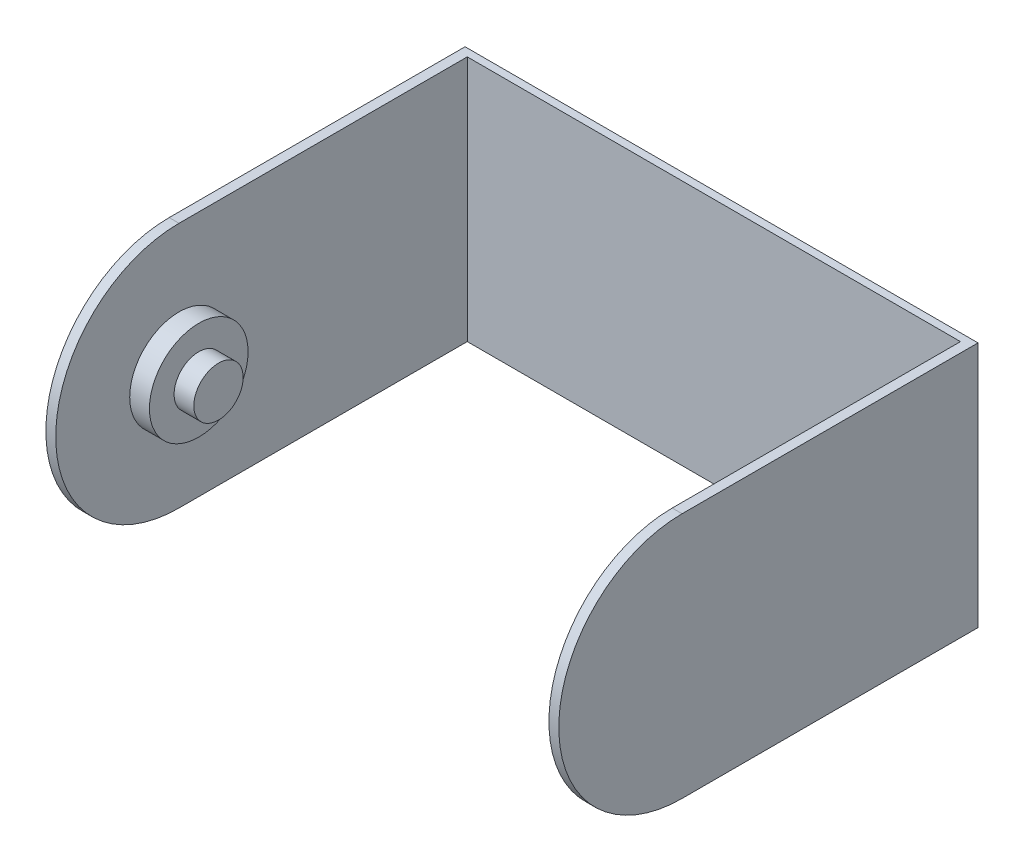
from build123d import *

# Parameters (mm, degrees)
BOSS_EXTRU_1_DEPTH = 25
BOSS_EXTRU_2_DEPTH = 1
BOSS_EXTRU_3_START = -1
BOSS_EXTRU_3_DEPTH = 1
ESQUISSE6_R        = 5
BOSS_EXTRU_4_DEPTH = 2
ESQUISSE7_R        = 2.5
BOSS_EXTRU_5_DEPTH = 2


with BuildPart() as part:
    # Esquisse1 → Boss.-Extru.1 (new body)
    with BuildSketch(Plane(origin=(0, 0, 0), x_dir=(1, 0, 0), z_dir=(0, 1, 0))):
        Polygon((-3.234042553, -21.946808511), (-2.234042553, -21.946808511), (-2.234042553, 7.275558935), (47.765957447, 7.275558935), (47.765957447, -21.946808511), (48.765957447, -21.946808511), (48.765957447, 8.053191489), (-3.234042553, 8.053191489), align=None)
    extrude(amount=BOSS_EXTRU_1_DEPTH)

    # Esquisse3 → Boss.-Extru.2 (add)
    with BuildSketch(Plane.ZY.offset(3.234042553)):
        with BuildLine():
            Line((21.946808511, 25), (21.946808511, 0))
            ThreePointArc((21.946808511, 0), (34.446808511, 12.5), (21.946808511, 25))
        make_face()
    extrude(amount=-BOSS_EXTRU_2_DEPTH)

    # Esquisse4 → Boss.-Extru.3 (add)
    with BuildSketch(Plane(origin=(48.765957447, 0, 0), x_dir=(0, 0, -1), z_dir=(1, 0, 0)).offset(BOSS_EXTRU_3_START)):
        with BuildLine():
            Line((-21.946808511, 25), (-21.946808511, 0))
            ThreePointArc((-21.946808511, 0), (-34.446808511, 12.5), (-21.946808511, 25))
        make_face()
    extrude(amount=BOSS_EXTRU_3_DEPTH)

    # Esquisse6 → Boss.-Extru.4 (add)
    with BuildSketch(Plane(origin=(-2.234042553, 0, 0), x_dir=(0, 0, -1), z_dir=(1, 0, 0))):
        with Locations(Location((-21.946808511, 12.22196254, 0), (0, 0, 180))):
            Circle(ESQUISSE6_R)
    extrude(amount=BOSS_EXTRU_4_DEPTH)

    # Esquisse7 → Boss.-Extru.5 (add)
    with BuildSketch(Plane(origin=(-0.234042553, 0, 0), x_dir=(0, 0, -1), z_dir=(1, 0, 0))):
        with Locations((-21.946808511, 12.22196254)):
            Circle(ESQUISSE7_R)
    extrude(amount=BOSS_EXTRU_5_DEPTH)


solid = part.part
